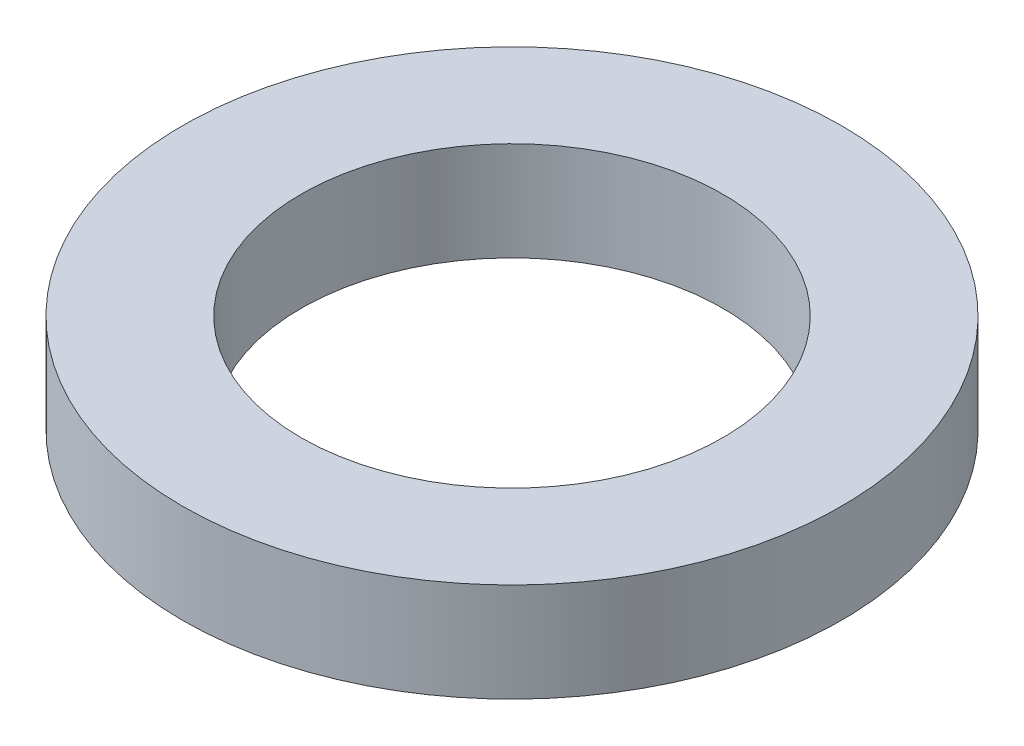
from build123d import *

# Parameters (mm, degrees)
ESQUISSE1_R        = 5
ESQUISSE1_R_2      = 3.2
BOSS_EXTRU_1_DEPTH = 1.5


with BuildPart() as part:
    # Esquisse1 → Boss.-Extru.1 (new body)
    with BuildSketch(Plane(origin=(0, 0, 0), x_dir=(1, 0, 0), z_dir=(0, 1, 0))):
        with Locations(Location((0, 0, 0), (0, 0, 270))):
            Circle(ESQUISSE1_R)
        with Locations(Location((0, 0, 0), (0, 0, 270))):
            Circle(ESQUISSE1_R_2, mode=Mode.SUBTRACT)
    extrude(amount=BOSS_EXTRU_1_DEPTH)


solid = part.part
